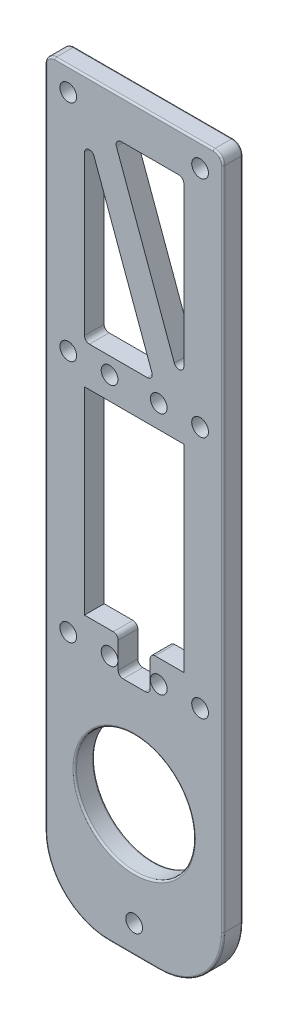
from build123d import *

# Parameters (mm, degrees)
SKETCH1_R          = 12.1
SKETCH1_W          = 20.2
SKETCH1_H          = 40.2
BASE_PLATE_DEPTH   = 4
FILLET1_R          = 1
FILLET2_R          = 2
SKETCH2_R          = 1.7
CUT_EXTRUDE1_DEPTH = 78.256779638
SKETCH5_W          = 6.5
SKETCH5_H          = 7.3
CUT_EXTRUDE3_DEPTH = 78.256779638
FILLET4_R          = 1
FILLET5_R          = 0.35


with BuildPart() as part:
    # Sketch1 → Base Plate (new body)
    with BuildSketch(Plane.XY):
        with BuildLine():
            Line((-18.1, -62), (-18.1, 75))
            Line((-18.1, 75), (18.1, 75))
            Line((18.1, 75), (18.1, -62))
            ThreePointArc((18.1, -62), (14.292388155, -71.192388155), (5.1, -75))
            Line((5.1, -75), (-5.1, -75))
            ThreePointArc((-5.1, -75), (-14.292388155, -71.192388155), (-18.1, -62))
        make_face()
        with Locations((0, -48.3)):
            Circle(SKETCH1_R, mode=Mode.SUBTRACT)
        Polygon((-10.1, 28.1), (4.1, 28.1), (-10.1, 67), align=None, mode=Mode.SUBTRACT)
        Rectangle(SKETCH1_W, SKETCH1_H, mode=Mode.SUBTRACT)
        Polygon((10.1, 67), (-4.1, 67), (10.1, 28.1), align=None, mode=Mode.SUBTRACT)
    extrude(amount=BASE_PLATE_DEPTH)

    # Fillet1
    fillet1_edges = [part.edges().sort_by_distance(p)[0] for p in [
        (-4.1, 67, 2),
        (10.1, 67, 2),
        (-10.1, 67, 2),
        (-10.1, 28.1, 2),
        (4.1, 28.1, 2),
        (10.1, 28.1, 2),
    ]]
    fillet(fillet1_edges, radius=FILLET1_R)

    # Fillet2
    fillet2_edges = [part.edges().sort_by_distance(p)[0] for p in [
        (-18.1, 75, 2),
        (18.1, 75, 2),
    ]]
    fillet(fillet2_edges, radius=FILLET2_R)

    # Sketch2 → Cut-Extrude1 (cut, through all)
    with BuildSketch(Plane.XY.offset(4)):
        with Locations((5, 24.75)):
            Circle(SKETCH2_R)
        with Locations((-5, 24.75)):
            Circle(SKETCH2_R)
        with Locations((-5, -24.75)):
            Circle(SKETCH2_R)
        with Locations((5, -24.75)):
            Circle(SKETCH2_R)
        with Locations((13.4, 24.75)):
            Circle(SKETCH2_R)
        with Locations((-13.4, 24.75)):
            Circle(SKETCH2_R)
        with Locations((13.4, -24.75)):
            Circle(SKETCH2_R)
        with Locations((-13.4, -24.75)):
            Circle(SKETCH2_R)
        with Locations((13.4, 70.3)):
            Circle(SKETCH2_R)
        with Locations((-13.4, 70.3)):
            Circle(SKETCH2_R)
        with Locations((0, -69.3)):
            Circle(SKETCH2_R)
    extrude(amount=-CUT_EXTRUDE1_DEPTH, mode=Mode.SUBTRACT)

    # Sketch5 → Cut-Extrude3 (cut, through all)
    with BuildSketch(Plane.XY.offset(4)):
        with Locations((0, -23.75)):
            Rectangle(SKETCH5_W, SKETCH5_H)
    extrude(amount=-CUT_EXTRUDE3_DEPTH, mode=Mode.SUBTRACT)

    # Fillet4
    fillet4_edges = [part.edges().sort_by_distance(p)[0] for p in [
        (3.25, -27.4, 2),
        (-3.25, -27.4, 2),
        (3.25, -20.1, 2),
        (-3.25, -20.1, 2),
    ]]
    fillet(fillet4_edges, radius=FILLET4_R)

    # Fillet5
    fillet5_edges = [part.edges().sort_by_distance(p)[0] for p in [
        (-17.514213562, 74.414213562, 4),
        (0, 75, 4),
        (17.514213562, 74.414213562, 4),
        (18.1, 5.5, 4),
        (14.292388155, -71.192388155, 4),
        (0, -75, 4),
        (-14.292388155, -71.192388155, 4),
        (-18.1, 5.5, 0),
        (-17.514213562, 74.414213562, 0),
        (0, 75, 0),
        (17.514213562, 74.414213562, 0),
        (18.1, 5.5, 0),
        (14.292388155, -71.192388155, 0),
        (0, -75, 0),
        (-18.1, 5.5, 4),
        (-14.292388155, -71.192388155, 0),
        (-12.1, -48.3, 0),
        (-12.1, -48.3, 4),
    ]]
    fillet(fillet5_edges, radius=FILLET5_R)


solid = part.part
